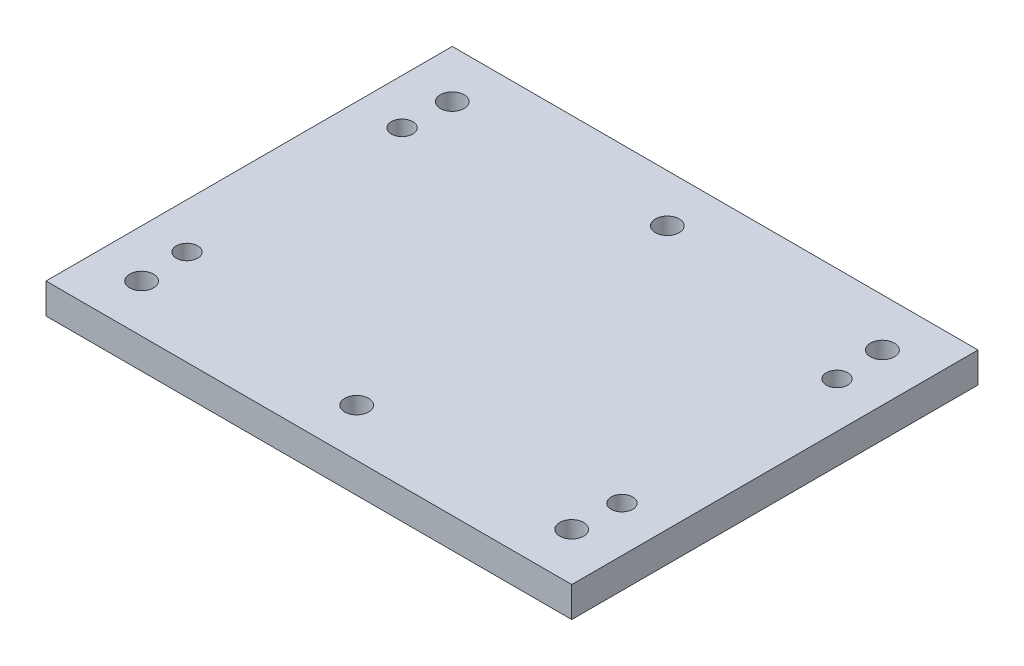
from build123d import *

# Parameters (mm, degrees)
BOSS_EXTRUDE1_DEPTH      = 3.175
BOSS_EXTRUDE1_DEPTH_BACK = 3.175
SKETCH1_W                = 110
SKETCH1_H                = 85
SKETCH1_R                = 2.25
SKETCH1_R_2              = 2.5


with BuildPart() as part:
    # Sketch1 → Boss-Extrude1 (new, two sides: drawn at the far end of the back side and taken through both)
    with BuildSketch(Plane(origin=(0, 0, 0), x_dir=(1, 0, 0), z_dir=(0, 1, 0)).offset(-BOSS_EXTRUDE1_DEPTH_BACK)):
        Rectangle(SKETCH1_W, SKETCH1_H)
        with Locations((-45.5, 22.5)):
            Circle(SKETCH1_R, mode=Mode.SUBTRACT)
        with Locations((45.5, 22.5)):
            Circle(SKETCH1_R, mode=Mode.SUBTRACT)
        with Locations((45.5, -22.5)):
            Circle(SKETCH1_R, mode=Mode.SUBTRACT)
        with Locations((-45.5, -22.5)):
            Circle(SKETCH1_R, mode=Mode.SUBTRACT)
        with Locations((45, -32.5)):
            Circle(SKETCH1_R_2, mode=Mode.SUBTRACT)
        with Locations((-45, -32.5)):
            Circle(SKETCH1_R_2, mode=Mode.SUBTRACT)
        with Locations((-45, 32.5)):
            Circle(SKETCH1_R_2, mode=Mode.SUBTRACT)
        with Locations((45, 32.5)):
            Circle(SKETCH1_R_2, mode=Mode.SUBTRACT)
        with Locations((0, -32.5)):
            Circle(SKETCH1_R_2, mode=Mode.SUBTRACT)
        with Locations((0, 32.5)):
            Circle(SKETCH1_R_2, mode=Mode.SUBTRACT)
    extrude(amount=BOSS_EXTRUDE1_DEPTH + BOSS_EXTRUDE1_DEPTH_BACK)


solid = part.part
